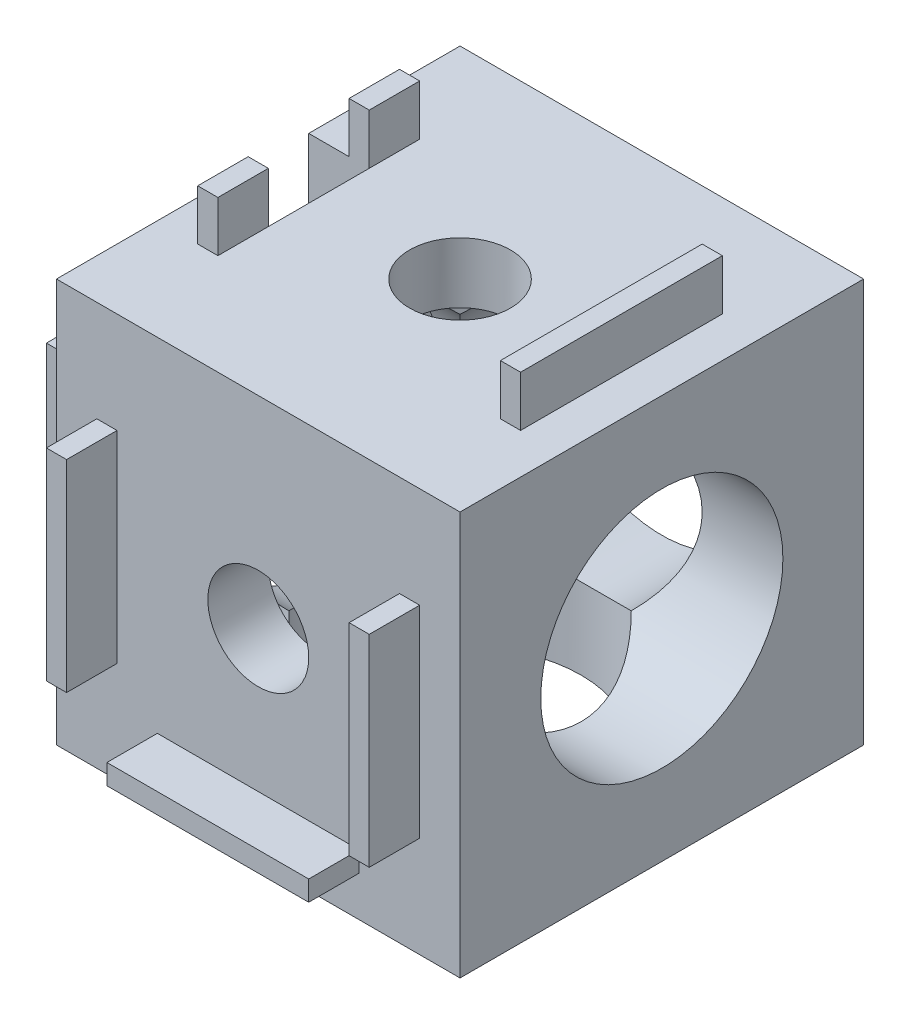
from build123d import *

# Parameters (mm, degrees)
BOSS_EXTRUDE1_DEPTH = 20
SKETCH2_W           = 1
SKETCH2_H           = 2.5
SKETCH2_H_2         = 10
BOSS_EXTRUDE2_DEPTH = 2.5
SKETCH2_3_R         = 2.5
CUT_EXTRUDE1_DEPTH  = 35.641016151
SKETCH3_W           = 1
SKETCH3_H           = 10
BOSS_EXTRUDE3_DEPTH = 2.5
SKETCH4_W           = 1
SKETCH4_H           = 10
SKETCH4_W_2         = 10
SKETCH4_H_2         = 1
BOSS_EXTRUDE4_DEPTH = 2.5
SKETCH4_3_R         = 2.5
CUT_EXTRUDE2_DEPTH  = 37.142080737
SKETCH5_R           = 6
CUT_EXTRUDE3_DEPTH  = 17
SKETCH6_R           = 6
CUT_EXTRUDE4_DEPTH  = 17
SKETCH7_R           = 6
CUT_EXTRUDE5_DEPTH  = 17


with BuildPart() as part:
    # Sketch1 → Boss-Extrude1 (new body)
    with BuildSketch(Plane(origin=(0, 0, 0), x_dir=(1, 0, 0), z_dir=(0, 1, 0))):
        Polygon((0, 7.5), (3, 7.5), (3, 12.5), (0, 12.5), (0, 20), (20, 20), (20, 0), (0, 0), align=None)
    extrude(amount=BOSS_EXTRUDE1_DEPTH)

    # Sketch2 → Boss-Extrude2 (add)
    with BuildSketch(Plane(origin=(0, 20, 0), x_dir=(1, 0, 0), z_dir=(0, 1, 0))):
        with Locations((2.5, 6.25)):
            Rectangle(SKETCH2_W, SKETCH2_H)
        with Locations((2.5, 13.75)):
            Rectangle(SKETCH2_W, SKETCH2_H)
        with Locations((17.5, 10)):
            Rectangle(SKETCH2_W, SKETCH2_H_2)
    extrude(amount=BOSS_EXTRUDE2_DEPTH)

    # Sketch2<3> → Cut-Extrude1 (cut, through all)
    with BuildSketch(Plane(origin=(0, 20, 0), x_dir=(1, 0, 0), z_dir=(0, 1, 0))):
        with Locations(Location((10, 10, 0), (0, 0, 270))):
            Circle(SKETCH2_3_R)
    extrude(amount=-CUT_EXTRUDE1_DEPTH, mode=Mode.SUBTRACT)

    # Sketch3 → Boss-Extrude3 (add)
    with BuildSketch(Plane.ZY):
        with Locations((-2.5, 10)):
            Rectangle(SKETCH3_W, SKETCH3_H)
        with Locations((-17.5, 10)):
            Rectangle(SKETCH3_W, SKETCH3_H)
    extrude(amount=BOSS_EXTRUDE3_DEPTH)

    # Sketch4 → Boss-Extrude4 (add)
    with BuildSketch(Plane(origin=(0, 0, 0), x_dir=(-1, 0, 0), z_dir=(0, 0, -1))):
        with Locations((-17.5, 10)):
            Rectangle(SKETCH4_W, SKETCH4_H)
        with Locations((-2.5, 10)):
            Rectangle(SKETCH4_W, SKETCH4_H)
        with Locations((-10, 2.5)):
            Rectangle(SKETCH4_W_2, SKETCH4_H_2)
    extrude(amount=-BOSS_EXTRUDE4_DEPTH)

    # Sketch4<3> → Cut-Extrude2 (cut, through all)
    with BuildSketch(Plane(origin=(0, 0, 0), x_dir=(-1, 0, 0), z_dir=(0, 0, -1))):
        with Locations(Location((-10, 10, 0), (0, 0, 180))):
            Circle(SKETCH4_3_R)
    extrude(amount=CUT_EXTRUDE2_DEPTH, mode=Mode.SUBTRACT)

    # Sketch5 → Cut-Extrude3 (cut)
    with BuildSketch(Plane(origin=(20, 0, 0), x_dir=(0, 0, -1), z_dir=(1, 0, 0))):
        with Locations((10, 10)):
            Circle(SKETCH5_R)
    extrude(amount=-CUT_EXTRUDE3_DEPTH, mode=Mode.SUBTRACT)

    # Sketch6 → Cut-Extrude4 (cut)
    with BuildSketch(Plane.XY.offset(-20)):
        with Locations(Location((10, 10, 0), (0, 0, 107.135224795))):
            Circle(SKETCH6_R)
    extrude(amount=CUT_EXTRUDE4_DEPTH, mode=Mode.SUBTRACT)

    # Sketch7 → Cut-Extrude5 (cut)
    with BuildSketch(Plane.XZ):
        with Locations(Location((10, -10, 0), (0, 0, 270))):
            Circle(SKETCH7_R)
    extrude(amount=-CUT_EXTRUDE5_DEPTH, mode=Mode.SUBTRACT)


solid = part.part
